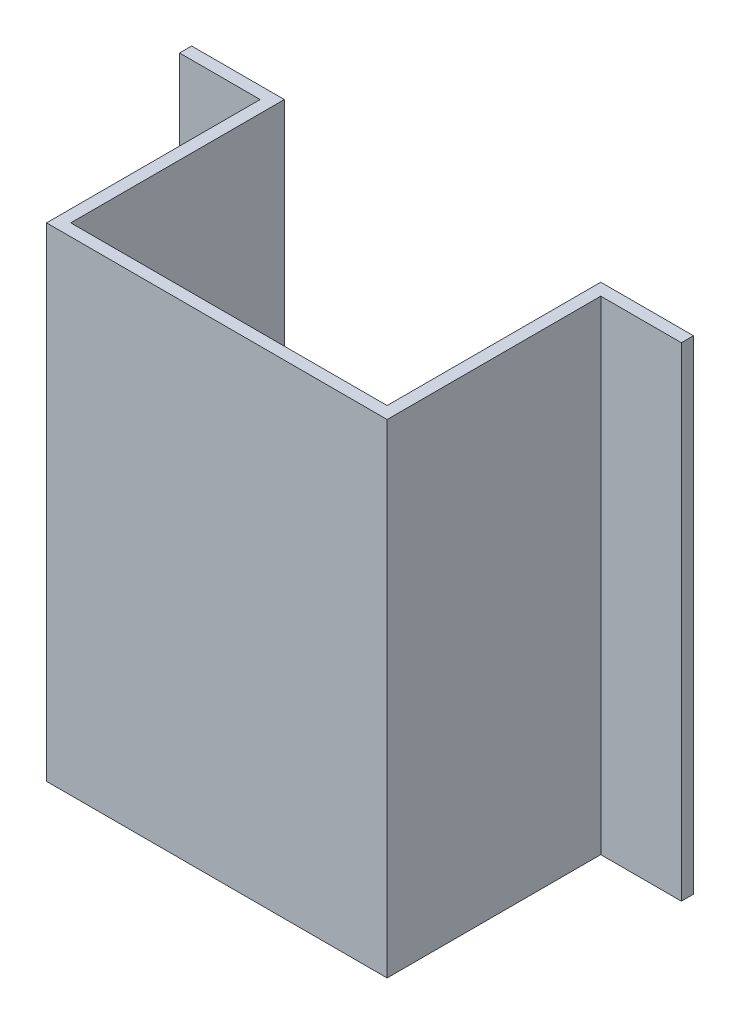
from build123d import *

# Parameters (mm, degrees)
SKETCH_1_W          = 84.5
SKETCH_1_H          = 120
EXTRUDE_1_DEPTH     = 56
SKETCH_2_W          = 78.5
SKETCH_2_H          = 53
CUT_EXTRUDE_1_DEPTH = 140.00022482
SKETCH_3_W          = 3
SKETCH_3_H          = 120
EXTRUDE_2_DEPTH     = 20


with BuildPart() as part:
    # 스케치1 → 보스-돌출1 (new body)
    with BuildSketch(Plane.XY):
        Rectangle(SKETCH_1_W, SKETCH_1_H)
    extrude(amount=EXTRUDE_1_DEPTH)

    # 스케치2 → 컷-돌출1 (cut, through all)
    with BuildSketch(Plane(origin=(0, 60, 0), x_dir=(1, 0, 0), z_dir=(0, 1, 0))):
        with Locations((0, -26.5)):
            Rectangle(SKETCH_2_W, SKETCH_2_H)
    extrude(amount=-CUT_EXTRUDE_1_DEPTH, mode=Mode.SUBTRACT)

    # 스케치3 → 보스-돌출2 (add)
    with BuildSketch(Plane.ZY.offset(42.25)):
        with Locations((1.5, 0)):
            Rectangle(SKETCH_3_W, SKETCH_3_H)
    extrude_2 = extrude(amount=EXTRUDE_2_DEPTH)

    # 대칭 복사1: 보스-돌출2 across plane
    add(extrude_2.mirror(Plane(origin=(0, 0, 0), x_dir=(0, 0, 1), z_dir=(1, 0, 0))))


solid = part.part
